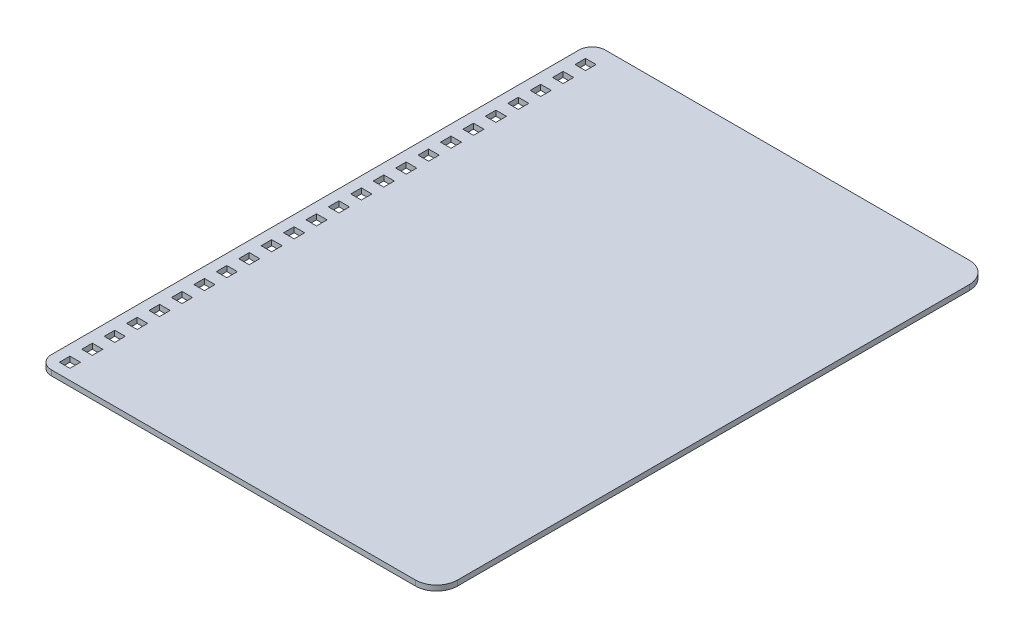
from build123d import *

# Parameters (mm, degrees)
BOSS_EXTRUDE1_DEPTH = 2
SKETCH2_W           = 4
SKETCH2_H           = 4
CUT_EXTRUDE1_DEPTH  = 2
LPATTERN1_COUNT     = 24
LPATTERN1_PITCH     = 8.5


with BuildPart() as part:
    # Sketch1 → Boss-Extrude1 (new body)
    with BuildSketch(Plane(origin=(0, 0, 0), x_dir=(1, 0, 0), z_dir=(0, 1, 0))):
        with BuildLine():
            Line((5, 0), (143, 0))
            ThreePointArc((143, 0), (148.656854249, 2.343145751), (151, 8))
            Line((151, 8), (151, 202))
            ThreePointArc((151, 202), (148.656854249, 207.656854249), (143, 210))
            Line((143, 210), (5, 210))
            ThreePointArc((5, 210), (1.464466094, 208.535533906), (0, 205))
            Line((0, 205), (0, 5))
            ThreePointArc((0, 5), (1.464466094, 1.464466094), (5, 0))
        make_face()
    extrude(amount=BOSS_EXTRUDE1_DEPTH)

    # Sketch2 → Cut-Extrude1 (cut)
    with BuildSketch(Plane(origin=(0, 2, 0), x_dir=(1, 0, 0), z_dir=(0, 1, 0))):
        with Locations((6, 201.5)):
            Rectangle(SKETCH2_W, SKETCH2_H)
    cut_extrude1 = extrude(amount=-CUT_EXTRUDE1_DEPTH, mode=Mode.SUBTRACT)

    # LPattern1: Cut-Extrude1 ×24
    with Locations(*[(0, 0, i * LPATTERN1_PITCH) for i in range(1, LPATTERN1_COUNT)]):
        add(cut_extrude1, mode=Mode.SUBTRACT)


solid = part.part
